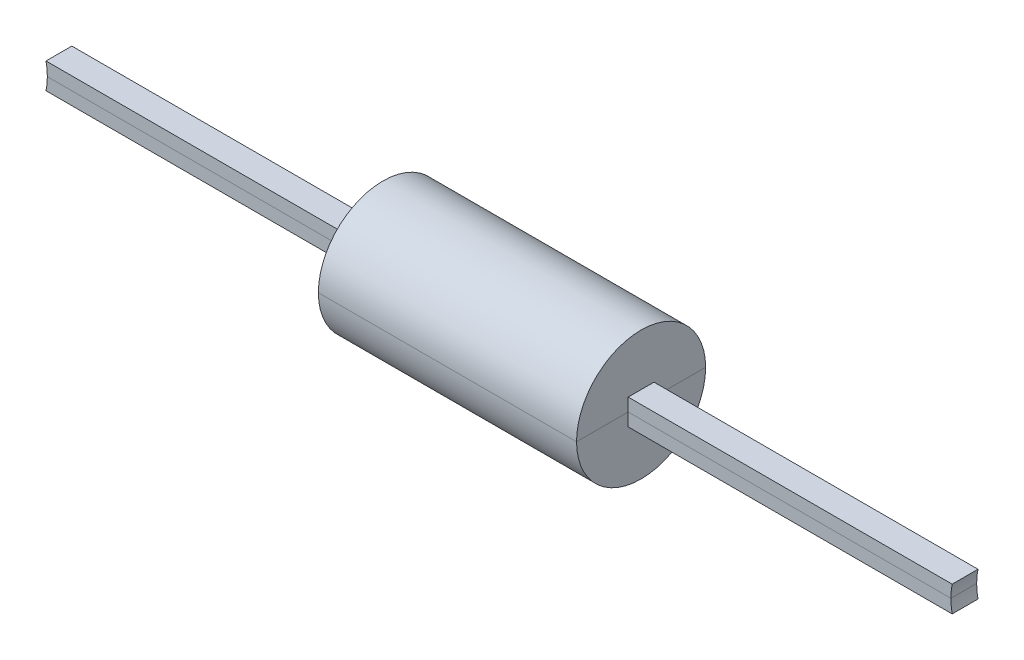
from build123d import *

# Parameters (mm, degrees)
SKETCH1_R           = 5
BOSS_EXTRUDE1_DEPTH = 10
BOSS_EXTRUDE5_DEPTH = 1


with BuildPart() as part:
    # Sketch1 → Boss-Extrude1 (new, symmetric)
    with BuildSketch(Plane(origin=(0, 0, 0), x_dir=(0, 0, -1), z_dir=(1, 0, 0))):
        Circle(SKETCH1_R)
    extrude(amount=BOSS_EXTRUDE1_DEPTH, both=True)

    # Sketch5 → Boss-Extrude5 (add, symmetric)
    with BuildSketch(Plane.XY):
        with BuildLine():
            Line((35.101020514, 1), (-35.101020514, 1))
            ThreePointArc((-35.101020514, 1), (-35.025319235, 0.50254481), (-35, 0))
            ThreePointArc((-35, 0), (-35.025319235, -0.50254481), (-35.101020514, -1))
            Line((-35.101020514, -1), (35.101020514, -1))
            ThreePointArc((35.101020514, -1), (35, 0), (35.101020514, 1))
        make_face()
    extrude(amount=BOSS_EXTRUDE5_DEPTH, both=True)


with BuildPart() as body_2:
    # Split1: the piece on the far side of the plane
    add(part.part)
    split(bisect_by=Plane.ZX, keep=Keep.BOTTOM)


with BuildPart() as part_1:
    add(part.part)

    # Split1
    split(bisect_by=Plane.ZX, keep=Keep.TOP)


solid = Compound([body_2.part, part_1.part])
